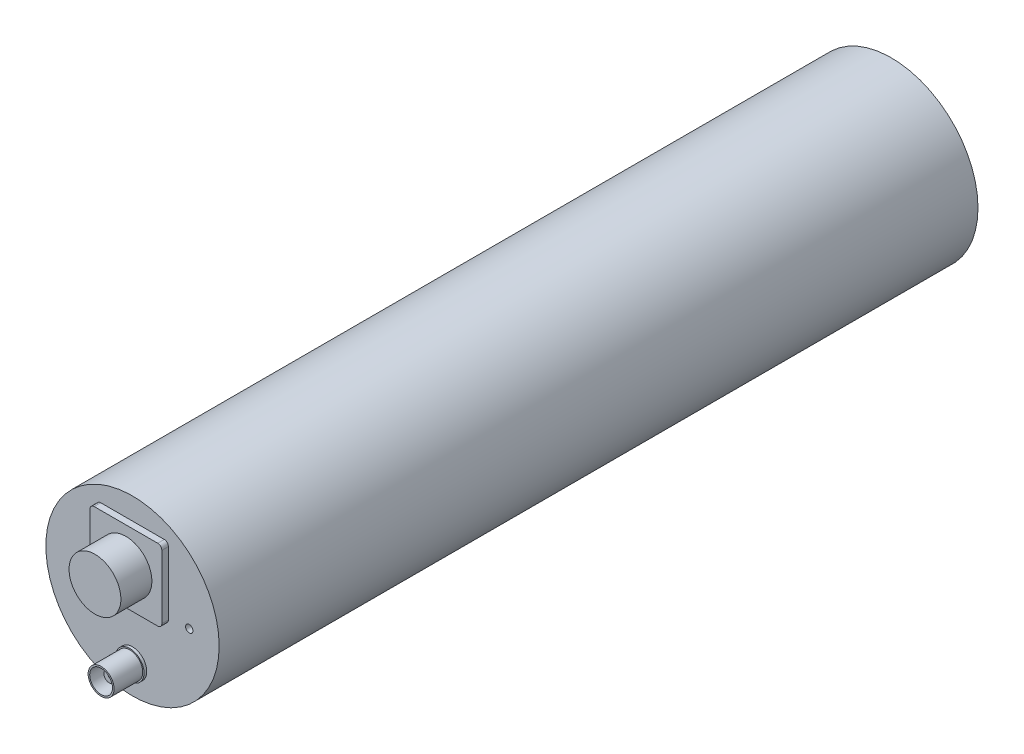
from build123d import *

# Parameters (mm, degrees)
SKETCH1_R                 = 31.75
BOSS_EXTRUDE1_DEPTH       = 139
SKETCH3_R                 = 9.5
BOSS_EXTRUDE2_DEPTH       = 2.4
SKETCH3_2_R               = 9.5
BOSS_EXTRUDE3_DEPTH       = 13.75
F_6_32_TAPPED_HOLE1_D     = 2.7051
F_6_32_TAPPED_HOLE1_DEPTH = 9.39
F_6_32_TAPPED_HOLE1_TIP   = 0.81269403
BOSS_EXTRUDE4_DEPTH       = 2.5
SKETCH7_3_R               = 5
BOSS_EXTRUDE5_DEPTH       = 8.33
SKETCH7_4_R               = 5
BOSS_EXTRUDE6_DEPTH       = 18.5
BOSS_EXTRUDE7_DEPTH       = 0.5


with BuildPart() as part:
    # Sketch1 → Boss-Extrude1 (new, symmetric)
    with BuildSketch(Plane.XY):
        Circle(SKETCH1_R)
    extrude(amount=BOSS_EXTRUDE1_DEPTH, both=True)

    # Sketch3 → Boss-Extrude2 (add)
    with BuildSketch(Plane.XY.offset(139)):
        with BuildLine():
            Line((11.6445, -2.539), (-11.6445, -2.539))
            ThreePointArc((-11.6445, -2.539), (-12.705160172, -2.099660172), (-13.1445, -1.039))
            Line((-13.1445, -1.039), (-13.1445, 22.25))
            ThreePointArc((-13.1445, 22.25), (-12.705160172, 23.310660172), (-11.6445, 23.75))
            Line((-11.6445, 23.75), (11.6445, 23.75))
            ThreePointArc((11.6445, 23.75), (12.705160172, 23.310660172), (13.1445, 22.25))
            Line((13.1445, 22.25), (13.1445, -1.039))
            ThreePointArc((13.1445, -1.039), (12.705160172, -2.099660172), (11.6445, -2.539))
        make_face()
        with Locations((0, 10.6055)):
            Circle(SKETCH3_R, mode=Mode.SUBTRACT)
    extrude(amount=BOSS_EXTRUDE2_DEPTH)

    # Sketch3<2> → Boss-Extrude3 (add)
    with BuildSketch(Plane.XY.offset(139)):
        with Locations((0, 10.6055)):
            Circle(SKETCH3_2_R)
    extrude(amount=BOSS_EXTRUDE3_DEPTH)

    # Sketch4 → Revolve1 (revolve)
    with BuildSketch(Plane(origin=(0, -21.35, 0), x_dir=(1, 0, 0), z_dir=(0, 1, 0))):
        Polygon((0, -139), (0, -143.5), (-0.25, -143.5), (-0.25, -147.5), (-2, -147.5), (-2, -141), (-4.175, -141), (-4.175, -150.5), (-4.75, -150.5), (-4.75, -140), (-5.22, -140), (-5.22, -139), align=None)
    revolve(axis=Axis((0, -21.35, 143.5), (0, 0, 1)))

    # #6-32 Tapped Hole1
    with Locations(Plane.XY.offset(139)):
        with Locations((-20.79625, 0), (20.79625, 0)):
            Hole(F_6_32_TAPPED_HOLE1_D / 2, depth=F_6_32_TAPPED_HOLE1_DEPTH)
            with Locations((0, 0, -(F_6_32_TAPPED_HOLE1_DEPTH + F_6_32_TAPPED_HOLE1_TIP / 2))):  # 118° drill point
                Cone(0, F_6_32_TAPPED_HOLE1_D / 2, F_6_32_TAPPED_HOLE1_TIP, mode=Mode.SUBTRACT)

    # Sketch7 → Boss-Extrude4 (add)
    with BuildSketch(Plane(origin=(0, 0, -139), x_dir=(-1, 0, 0), z_dir=(0, 0, -1))):
        Polygon((25.368802154, 8), (16.131197846, 8), (11.512395693, 0), (16.131197846, -8), (25.368802154, -8), (29.987604307, 0), align=None)
        with BuildLine():
            ThreePointArc((18.416186816, -5.797914799), (16.330582618, -4.419417382), (14.952085201, -2.333813184))
            ThreePointArc((14.952085201, -2.333813184), (19.56140156, 6.135937887), (27, 0))
            ThreePointArc((27, 0), (24.248297271, -5.179229306), (18.416186816, -5.797914799))
        make_face(mode=Mode.SUBTRACT)
    extrude(amount=BOSS_EXTRUDE4_DEPTH)

    # Sketch7<3> → Boss-Extrude5 (add)
    with BuildSketch(Plane(origin=(0, 0, -139), x_dir=(-1, 0, 0), z_dir=(0, 0, -1))):
        with BuildLine():
            ThreePointArc((27, 0), (19.56140156, 6.135937887), (14.952085201, -2.333813184))
            Line((14.952085201, -2.333813184), (18.416186816, -5.797914799))
            ThreePointArc((18.416186816, -5.797914799), (24.248297271, -5.179229306), (27, 0))
        make_face()
        with Locations((20.75, 0)):
            Circle(SKETCH7_3_R, mode=Mode.SUBTRACT)
    extrude(amount=BOSS_EXTRUDE5_DEPTH)

    # Sketch7<4> → Boss-Extrude6 (add)
    with BuildSketch(Plane(origin=(0, 0, -139), x_dir=(-1, 0, 0), z_dir=(0, 0, -1))):
        with Locations((20.75, 0)):
            Circle(SKETCH7_4_R)
    extrude(amount=BOSS_EXTRUDE6_DEPTH)

    # Sketch8 → Boss-Extrude7 (add)
    with BuildSketch(Plane(origin=(0, 0, -139), x_dir=(-1, 0, 0), z_dir=(0, 0, -1))):
        with BuildLine():
            Line((7.9125, 25.2), (-15.9125, 25.2))
            ThreePointArc((-15.9125, 25.2), (-17.035032015, 24.735032015), (-17.5, 23.6125))
            Line((-17.5, 23.6125), (-17.5, -23.6125))
            ThreePointArc((-17.5, -23.6125), (-17.035032015, -24.735032015), (-15.9125, -25.2))
            Line((-15.9125, -25.2), (7.9125, -25.2))
            ThreePointArc((7.9125, -25.2), (9.035032015, -24.735032015), (9.5, -23.6125))
            Line((9.5, -23.6125), (9.5, 23.6125))
            ThreePointArc((9.5, 23.6125), (9.035032015, 24.735032015), (7.9125, 25.2))
        make_face()
    extrude(amount=BOSS_EXTRUDE7_DEPTH)


solid = part.part
